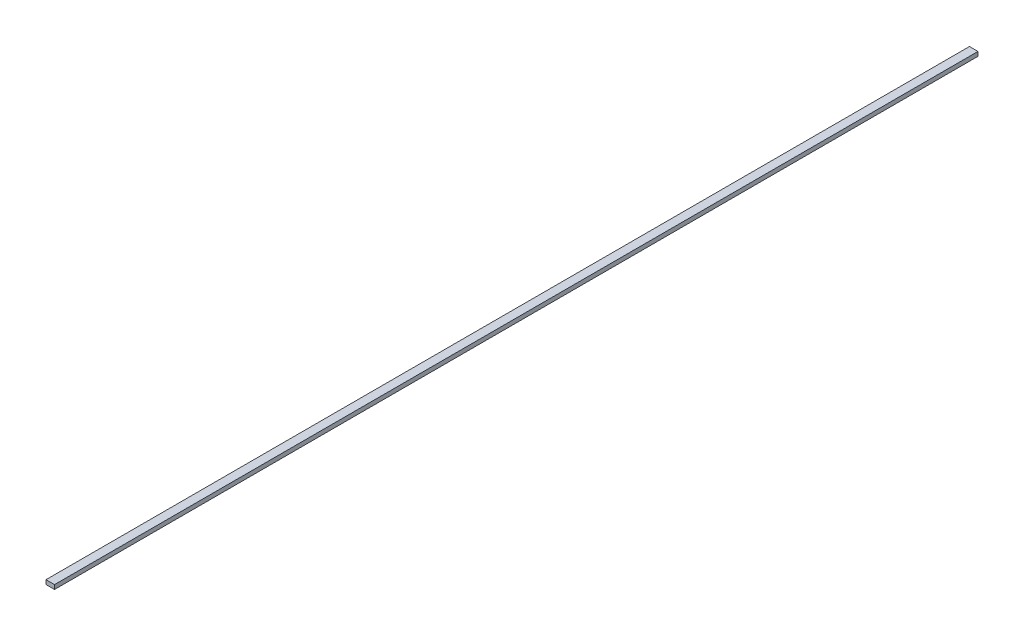
from build123d import *

# Parameters (mm, degrees)
KAYIS_GT3_6X3X650_1_START = -40
SKETCH1_W                 = 6
SKETCH1_H                 = 3
KAYIS_GT3_6X3X650_1_DEPTH = 650


with BuildPart() as part:
    # Sketch1 → KAYIS_GT3_6x3x650_1 (new body)
    with BuildSketch(Plane.XY.offset(KAYIS_GT3_6X3X650_1_START)):
        with Locations((3, 1.5)):
            Rectangle(SKETCH1_W, SKETCH1_H)
    extrude(amount=-KAYIS_GT3_6X3X650_1_DEPTH)


solid = part.part
